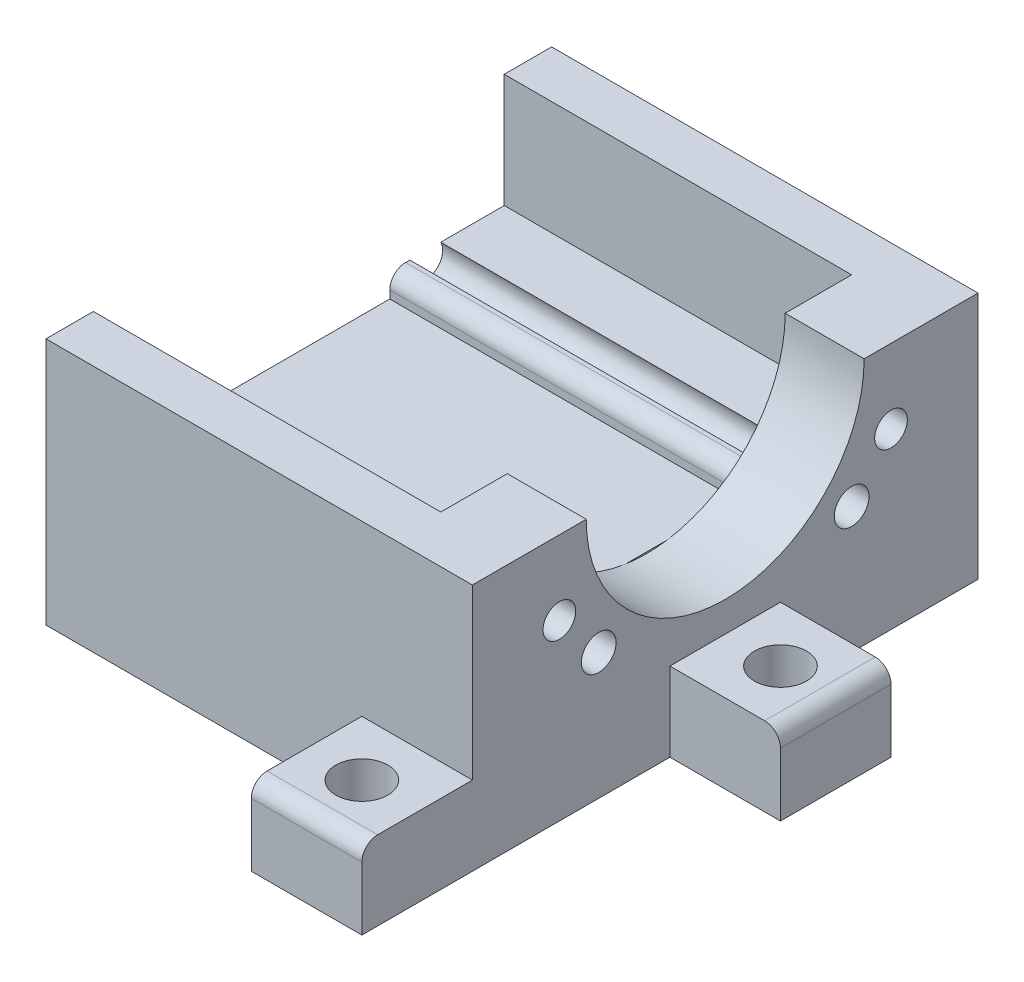
from build123d import *

# Parameters (mm, degrees)
BOSS_EXTRUDE1_DEPTH = 11
SKETCH3_W           = 22
SKETCH3_H           = 3
BOSS_EXTRUDE2_DEPTH = 15.7
BOSS_EXTRUDE3_DEPTH = 5
SKETCH5_R           = 1.035
SKETCH5_R_2         = 1.1
CUT_EXTRUDE1_DEPTH  = 36.096650541
SKETCH6_W           = 7
SKETCH6_H           = 7
BOSS_EXTRUDE4_DEPTH = 5
SKETCH7_R           = 1.65
CUT_EXTRUDE2_DEPTH  = 35.247620052
FILLET1_R           = 1


with BuildPart() as part:
    # Sketch1 → Boss-Extrude1 (new, symmetric)
    with BuildSketch(Plane(origin=(0, 0, 0), x_dir=(0, 0, -1), z_dir=(1, 0, 0))):
        Polygon((-13.0089, 0), (13.0089, 0), (13.0089, 8.5), (5.7589, 8.5), (5.7589, 7), (-5.7589, 7), (-5.7589, 8.5), (-13.0089, 8.5), align=None)
    extrude(amount=BOSS_EXTRUDE1_DEPTH, both=True)

    # Sketch3 → Boss-Extrude2 (add)
    with BuildSketch(Plane.XZ):
        with Locations((0, -14.5089)):
            Rectangle(SKETCH3_W, SKETCH3_H)
        with Locations((0, 14.5089)):
            Rectangle(SKETCH3_W, SKETCH3_H)
    extrude(amount=-BOSS_EXTRUDE2_DEPTH)

    # Sketch4 → Boss-Extrude3 (add)
    with BuildSketch(Plane(origin=(11, 0, 0), x_dir=(0, 0, -1), z_dir=(1, 0, 0))):
        with BuildLine():
            Line((-8.8, 15.7), (-16.0089, 15.7))
            Line((-16.0089, 15.7), (-16.0089, 0))
            Line((-16.0089, 0), (16.0089, 0))
            Line((16.0089, 0), (16.0089, 15.7))
            Line((16.0089, 15.7), (8.8, 15.7))
            ThreePointArc((8.8, 15.7), (0, 6.9), (-8.8, 15.7))
        make_face()
    extrude(amount=BOSS_EXTRUDE3_DEPTH)

    # Sketch5 → Cut-Extrude1 (cut, through all)
    with BuildSketch(Plane(origin=(16, 0, 0), x_dir=(0, 0, -1), z_dir=(1, 0, 0))):
        with Locations((-10.5, 11)):
            Circle(SKETCH5_R)
        with Locations((10.5, 11)):
            Circle(SKETCH5_R)
        with Locations((-8.0089, 8)):
            Circle(SKETCH5_R_2)
        with Locations(Location((8.0089, 8, 0), (0, 0, 27.035691789))):
            Circle(SKETCH5_R_2)
    extrude(amount=-CUT_EXTRUDE1_DEPTH, mode=Mode.SUBTRACT)

    # Sketch6 → Boss-Extrude4 (add)
    with BuildSketch(Plane.XZ):
        with Locations((19.5, 0)):
            Rectangle(SKETCH6_W, SKETCH6_H)
        with Locations((12.5, 19.5089)):
            Rectangle(SKETCH6_W, SKETCH6_H)
    extrude(amount=-BOSS_EXTRUDE4_DEPTH)

    # Sketch7 → Cut-Extrude2 (cut, through all)
    with BuildSketch(Plane(origin=(0, 5, 0), x_dir=(1, 0, 0), z_dir=(0, 1, 0))):
        with Locations(Location((19.5, 0, 0), (0, 0, 270))):
            Circle(SKETCH7_R)
        with Locations(Location((12.5, -19.5089, 0), (0, 0, 270))):
            Circle(SKETCH7_R)
    extrude(amount=-CUT_EXTRUDE2_DEPTH, mode=Mode.SUBTRACT)

    # Fillet1
    fillet1_edges = [part.edges().sort_by_distance(p)[0] for p in [
        (23, 5, 0),
        (12.5, 5, 23.0089),
        (0, 8.5, 5.7589),
        (0, 8.5, -5.7589),
    ]]
    fillet(fillet1_edges, radius=FILLET1_R)


solid = part.part
